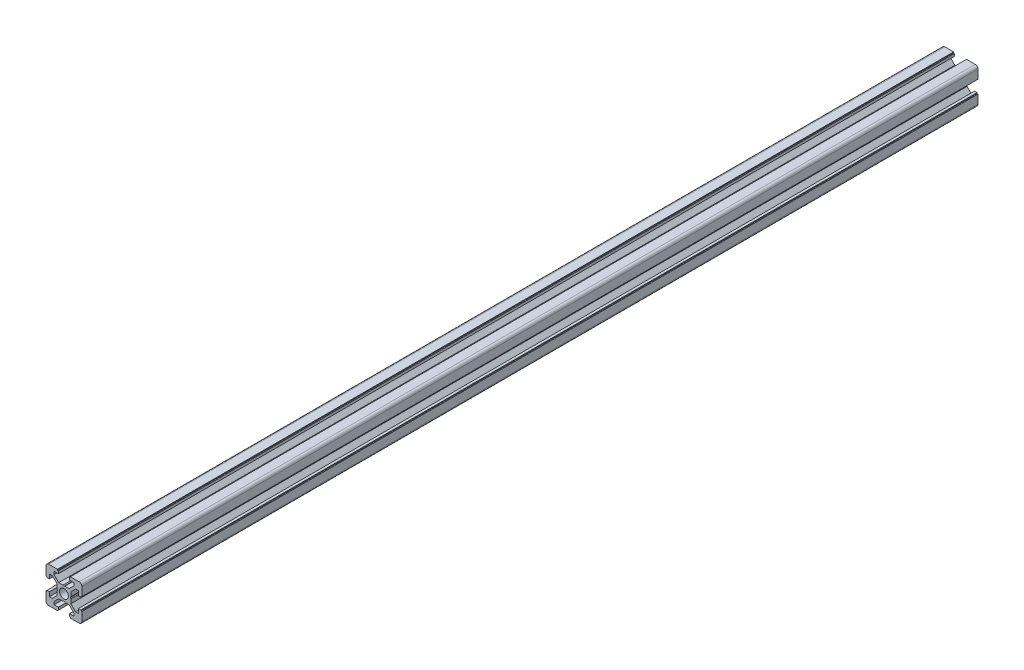
from build123d import *

# Parameters (mm, degrees)
MODEL_R         = 2.5
EXTRUDE_1_DEPTH = 500


with BuildPart() as part:
    # Model → 凸台-拉伸1 (new body)
    with BuildSketch(Plane.XY):
        with BuildLine():
            Line((-3.9, 0.519615242), (-3.6, 0))
            Line((-3.6, 0), (-3.9, -0.519615242))
            Line((-3.9, -0.519615242), (-3.9, -2.910050506))
            Line((-3.9, -2.910050506), (-6.489949494, -5.5))
            Line((-6.489949494, -5.5), (-8.1, -5.5))
            Line((-8.1, -5.5), (-8.1, -3.1))
            Line((-8.1, -3.1), (-9.5, -3.1))
            Line((-9.5, -3.1), (-9.5, -3.6))
            Line((-9.5, -3.6), (-10, -3.6))
            Line((-10, -3.6), (-10, -8.5))
            ThreePointArc((-10, -8.5), (-9.560660172, -9.560660172), (-8.5, -10))
            Line((-8.5, -10), (-3.6, -10))
            Line((-3.6, -10), (-3.6, -9.5))
            Line((-3.6, -9.5), (-3.1, -9.5))
            Line((-3.1, -9.5), (-3.1, -8.1))
            Line((-3.1, -8.1), (-5.5, -8.1))
            Line((-5.5, -8.1), (-5.5, -6.489949494))
            Line((-5.5, -6.489949494), (-2.910050506, -3.9))
            Line((-2.910050506, -3.9), (-0.519615242, -3.9))
            Line((-0.519615242, -3.9), (0, -3.6))
            Line((0, -3.6), (0.519615242, -3.9))
            Line((0.519615242, -3.9), (2.910050506, -3.9))
            Line((2.910050506, -3.9), (5.5, -6.489949494))
            Line((5.5, -6.489949494), (5.5, -8.1))
            Line((5.5, -8.1), (3.1, -8.1))
            Line((3.1, -8.1), (3.1, -9.5))
            Line((3.1, -9.5), (3.6, -9.5))
            Line((3.6, -9.5), (3.6, -10))
            Line((3.6, -10), (8.5, -10))
            ThreePointArc((8.5, -10), (9.560660172, -9.560660172), (10, -8.5))
            Line((10, -8.5), (10, -3.6))
            Line((10, -3.6), (9.5, -3.6))
            Line((9.5, -3.6), (9.5, -3.1))
            Line((9.5, -3.1), (8.1, -3.1))
            Line((8.1, -3.1), (8.1, -5.5))
            Line((8.1, -5.5), (6.489949494, -5.5))
            Line((6.489949494, -5.5), (3.9, -2.910050506))
            Line((3.9, -2.910050506), (3.9, -0.519615242))
            Line((3.9, -0.519615242), (3.6, 0))
            Line((3.6, 0), (3.9, 0.519615242))
            Line((3.9, 0.519615242), (3.9, 2.910050506))
            Line((3.9, 2.910050506), (6.489949494, 5.5))
            Line((6.489949494, 5.5), (8.1, 5.5))
            Line((8.1, 5.5), (8.1, 3.1))
            Line((8.1, 3.1), (9.5, 3.1))
            Line((9.5, 3.1), (9.5, 3.6))
            Line((9.5, 3.6), (10, 3.6))
            Line((10, 3.6), (10, 8.5))
            ThreePointArc((10, 8.5), (9.560660172, 9.560660172), (8.5, 10))
            Line((8.5, 10), (3.6, 10))
            Line((3.6, 10), (3.6, 9.5))
            Line((3.6, 9.5), (3.1, 9.5))
            Line((3.1, 9.5), (3.1, 8.1))
            Line((3.1, 8.1), (5.5, 8.1))
            Line((5.5, 8.1), (5.5, 6.489949494))
            Line((5.5, 6.489949494), (2.910050506, 3.9))
            Line((2.910050506, 3.9), (0.519615242, 3.9))
            Line((0.519615242, 3.9), (0, 3.6))
            Line((0, 3.6), (-0.519615242, 3.9))
            Line((-0.519615242, 3.9), (-2.910050506, 3.9))
            Line((-2.910050506, 3.9), (-5.5, 6.489949494))
            Line((-5.5, 6.489949494), (-5.5, 8.1))
            Line((-5.5, 8.1), (-3.1, 8.1))
            Line((-3.1, 8.1), (-3.1, 9.5))
            Line((-3.1, 9.5), (-3.6, 9.5))
            Line((-3.6, 9.5), (-3.6, 10))
            Line((-3.6, 10), (-8.5, 10))
            ThreePointArc((-8.5, 10), (-9.560660172, 9.560660172), (-10, 8.5))
            Line((-10, 8.5), (-10, 3.6))
            Line((-10, 3.6), (-9.5, 3.6))
            Line((-9.5, 3.6), (-9.5, 3.1))
            Line((-9.5, 3.1), (-8.1, 3.1))
            Line((-8.1, 3.1), (-8.1, 5.5))
            Line((-8.1, 5.5), (-6.489949494, 5.5))
            Line((-6.489949494, 5.5), (-3.9, 2.910050506))
            Line((-3.9, 2.910050506), (-3.9, 0.519615242))
        make_face()
        Circle(MODEL_R, mode=Mode.SUBTRACT)
    extrude(amount=EXTRUDE_1_DEPTH)


solid = part.part
